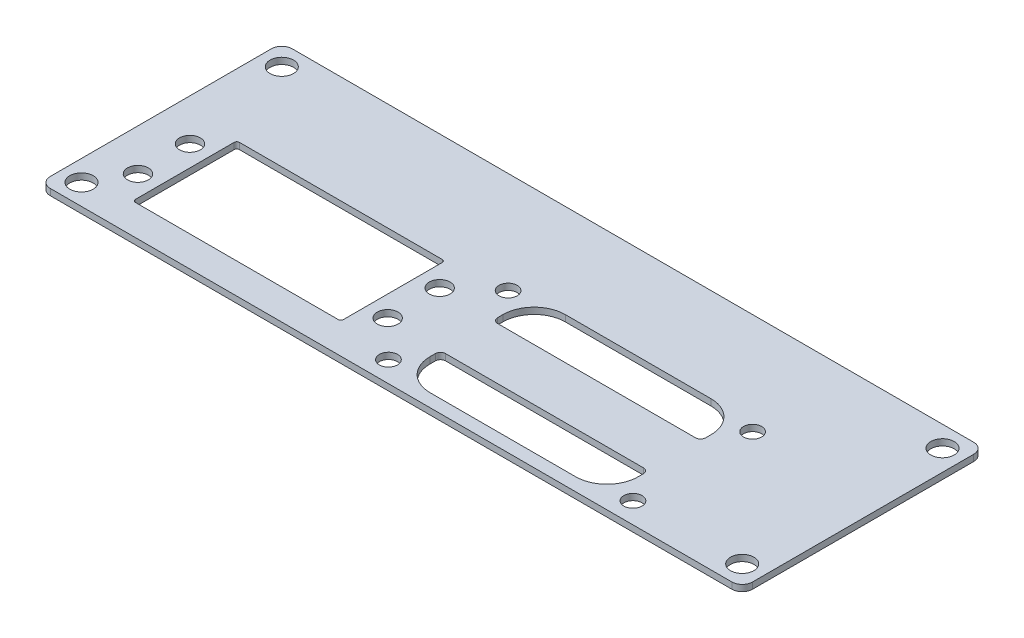
from build123d import *

# Parameters (mm, degrees)
BASE_R      = 2.25
BASE_R_2    = 1.75
BASE_R_3    = 2
SHEET_DEPTH = 1.2192


with BuildPart() as part:
    # BASE → SHEET (new body)
    with BuildSketch(Plane(origin=(0, 0, 0), x_dir=(1, 0, 0), z_dir=(0, 1, 0))):
        with BuildLine():
            Line((65.5, -23.25), (-65.5, -23.25))
            ThreePointArc((-65.5, -23.25), (-66.914213562, -22.664213562), (-67.5, -21.25))
            Line((-67.5, -21.25), (-67.5, 21.25))
            ThreePointArc((-67.5, 21.25), (-66.914213562, 22.664213562), (-65.5, 23.25))
            Line((-65.5, 23.25), (65.5, 23.25))
            ThreePointArc((65.5, 23.25), (66.914213562, 22.664213562), (67.5, 21.25))
            Line((67.5, 21.25), (67.5, -21.25))
            ThreePointArc((67.5, -21.25), (66.914213562, -22.664213562), (65.5, -23.25))
        make_face()
        with Locations(Location((-63.5, 19.25, 0), (0, 0, 270))):
            Circle(BASE_R, mode=Mode.SUBTRACT)
        with Locations(Location((-63.5, -19.25, 0), (0, 0, 270))):
            Circle(BASE_R, mode=Mode.SUBTRACT)
        with Locations(Location((63.5, -19.25, 0), (0, 0, 270))):
            Circle(BASE_R, mode=Mode.SUBTRACT)
        with Locations(Location((63.5, 19.25, 0), (0, 0, 270))):
            Circle(BASE_R, mode=Mode.SUBTRACT)
        with Locations(Location((-4.5, 3.75, 0), (0, 0, 270))):
            Circle(BASE_R_2, mode=Mode.SUBTRACT)
        with Locations(Location((42.5, 3.75, 0), (0, 0, 270))):
            Circle(BASE_R_2, mode=Mode.SUBTRACT)
        with Locations(Location((42.5, -19.25, 0), (0, 0, 270))):
            Circle(BASE_R_2, mode=Mode.SUBTRACT)
        with Locations(Location((-4.5, -19.25, 0), (0, 0, 270))):
            Circle(BASE_R_2, mode=Mode.SUBTRACT)
        with Locations(Location((-59.5, -2.4, 0), (0, 0, 270))):
            Circle(BASE_R_3, mode=Mode.SUBTRACT)
        with Locations(Location((-59.5, -12.4, 0), (0, 0, 270))):
            Circle(BASE_R_3, mode=Mode.SUBTRACT)
        with Locations(Location((-11.5, -2.4, 0), (0, 0, 270))):
            Circle(BASE_R_3, mode=Mode.SUBTRACT)
        with Locations(Location((-11.5, -12.4, 0), (0, 0, 270))):
            Circle(BASE_R_3, mode=Mode.SUBTRACT)
        with BuildLine():
            Line((5, -20.75), (33, -20.75))
            ThreePointArc((33, -20.75), (37.242640687, -18.992640687), (39, -14.75))
            Line((39, -14.75), (39, -13.75))
            ThreePointArc((39, -13.75), (38.707106781, -13.042893219), (38, -12.75))
            Line((38, -12.75), (0, -12.75))
            ThreePointArc((0, -12.75), (-0.707106781, -13.042893219), (-1, -13.75))
            Line((-1, -13.75), (-1, -14.75))
            ThreePointArc((-1, -14.75), (0.757359313, -18.992640687), (5, -20.75))
        make_face(mode=Mode.SUBTRACT)
        with BuildLine():
            Line((5, 5.25), (33, 5.25))
            ThreePointArc((33, 5.25), (37.242640687, 3.492640687), (39, -0.75))
            Line((39, -0.75), (39, -1.75))
            ThreePointArc((39, -1.75), (38.707106781, -2.457106781), (38, -2.75))
            Line((38, -2.75), (0, -2.75))
            ThreePointArc((0, -2.75), (-0.707106781, -2.457106781), (-1, -1.75))
            Line((-1, -1.75), (-1, -0.75))
            ThreePointArc((-1, -0.75), (0.757359313, 3.492640687), (5, 5.25))
        make_face(mode=Mode.SUBTRACT)
        with BuildLine():
            Line((-55, -17.4), (-16, -17.4))
            ThreePointArc((-16, -17.4), (-15.646446609, -17.253553391), (-15.5, -16.9))
            Line((-15.5, -16.9), (-15.5, 2.1))
            ThreePointArc((-15.5, 2.1), (-15.646446609, 2.453553391), (-16, 2.6))
            Line((-16, 2.6), (-55, 2.6))
            ThreePointArc((-55, 2.6), (-55.353553391, 2.453553391), (-55.5, 2.1))
            Line((-55.5, 2.1), (-55.5, -16.9))
            ThreePointArc((-55.5, -16.9), (-55.353553391, -17.253553391), (-55, -17.4))
        make_face(mode=Mode.SUBTRACT)
    extrude(amount=SHEET_DEPTH)


solid = part.part
